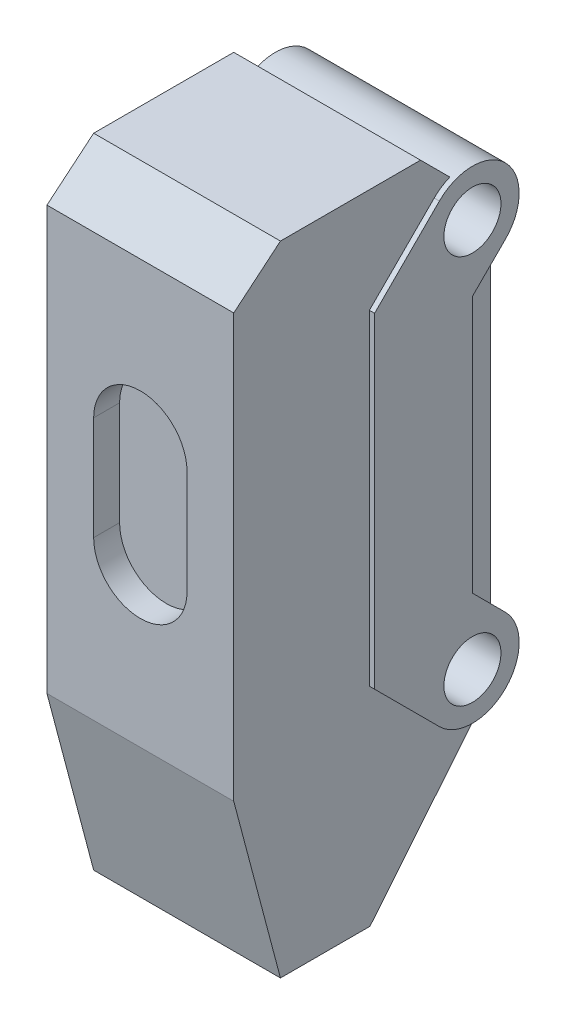
from build123d import *

# Parameters (mm, degrees)
SKETCH_1_W               = 7.2
SKETCH_1_H               = 24.6
EXTRUDE_1_DEPTH          = 10.8
CUT_EXTRUDE_3_DEPTH      = 7.2
CUT_EXTRUDE_1_DEPTH      = 10.8
EXTRUDE_START            = -3.6
SKETCH_3_R               = 1.1
EXTRUDE_3_DEPTH          = 3.8
CUT_EXTRUDE_2_DEPTH      = 18.963574255
CUT_EXTRUDE_2_DEPTH_BACK = 18.963574255
SKETCH_4_R               = 1.1
CUT_EXTRUDE_4_DEPTH      = 1


with BuildPart() as part:
    # 스케치1 → 보스-돌출1 (new body)
    with BuildSketch(Plane.XY):
        Rectangle(SKETCH_1_W, SKETCH_1_H)
    extrude(amount=EXTRUDE_1_DEPTH)

    # 스케치5 → 컷-돌출3 (cut)
    with BuildSketch(Plane.ZY.offset(3.6)):
        Polygon((0, 12.3), (0, 8.7), (3.6, 12.3), align=None)
    extrude(amount=-CUT_EXTRUDE_3_DEPTH, mode=Mode.SUBTRACT)

    # 스케치2 → 컷-돌출1 (cut)
    with BuildSketch(Plane(origin=(3.6, 0, 0), x_dir=(0, 0, -1), z_dir=(1, 0, 0))):
        Polygon((-10.8, -5.5), (-9, -12.3), (-10.8, -12.3), align=None)
        Polygon((-10.8, 12.3), (-10.8, 10.8), (-9, 12.3), align=None)
        Polygon((-0.9, 7.854415588), (-0.129530009, 8.829530009), (0, 8.7), (0, -5.394280654), (-0.129530009, -5.394280654), (-0.9, -3.854415588), align=None)
        Polygon((-5.55, -12.3), (0, -12.3), (0, -5.5), align=None)
    extrude(amount=-CUT_EXTRUDE_1_DEPTH, mode=Mode.SUBTRACT)

    # 스케치3 → 보스-돌출3 (add)
    with BuildSketch(Plane(origin=(3.6, 0, 0), x_dir=(0, 0, -1), z_dir=(1, 0, 0)).offset(EXTRUDE_START)):
        with BuildLine():
            Line((-3.072792206, 10.772792206), (-5.571079083, 8.27450533))
            Line((-5.571079083, 8.27450533), (-5.571079083, -4.27450533))
            Line((-5.571079083, -4.27450533), (-3.072792206, -6.772792206))
            ThreePointArc((-3.072792206, -6.772792206), (-0.527207794, -6.772792206), (-0.527207794, -4.227207794))
            Line((-0.527207794, -4.227207794), (-1.8, -2.954415588))
            Line((-1.8, -2.954415588), (-1.8, 6.954415588))
            Line((-1.8, 6.954415588), (-0.527207794, 8.227207794))
            ThreePointArc((-0.527207794, 8.227207794), (-0.527207794, 10.772792206), (-3.072792206, 10.772792206))
        make_face()
        with Locations(Location((-1.8, 9.5, 0), (0, 0, 90))):
            Circle(SKETCH_3_R, mode=Mode.SUBTRACT)
        with Locations(Location((-1.8, -5.5, 0), (0, 0, 90))):
            Circle(SKETCH_3_R, mode=Mode.SUBTRACT)
    extrude_3 = extrude(amount=EXTRUDE_3_DEPTH)

    # 스케치4 → 컷-돌출2 (cut, two sides: drawn at the far end of the back side and taken through both)
    with BuildSketch(Plane.ZY.offset(3.6).offset(-CUT_EXTRUDE_2_DEPTH_BACK)):
        with Locations(Location((1.8, 9.5, 0), (0, 0, 90))):
            Circle(SKETCH_4_R)
        with Locations(Location((1.8, -5.5, 0), (0, 0, 90))):
            Circle(SKETCH_4_R)
    extrude(amount=CUT_EXTRUDE_2_DEPTH + CUT_EXTRUDE_2_DEPTH_BACK, mode=Mode.SUBTRACT)

    # 대칭 복사2: 보스-돌출3 across plane
    add(extrude_3.mirror(Plane.ZY))

    # 스케치6 → 컷-돌출4 (cut)
    with BuildSketch(Plane.XY.offset(10.8)):
        with BuildLine():
            Line((1.8, 4.6), (1.8, 0.6))
            ThreePointArc((1.8, 0.6), (0, -1.2), (-1.8, 0.6))
            Line((-1.8, 0.6), (-1.8, 4.6))
            ThreePointArc((-1.8, 4.6), (0, 6.4), (1.8, 4.6))
        make_face()
    extrude(amount=-CUT_EXTRUDE_4_DEPTH, mode=Mode.SUBTRACT)


solid = part.part
